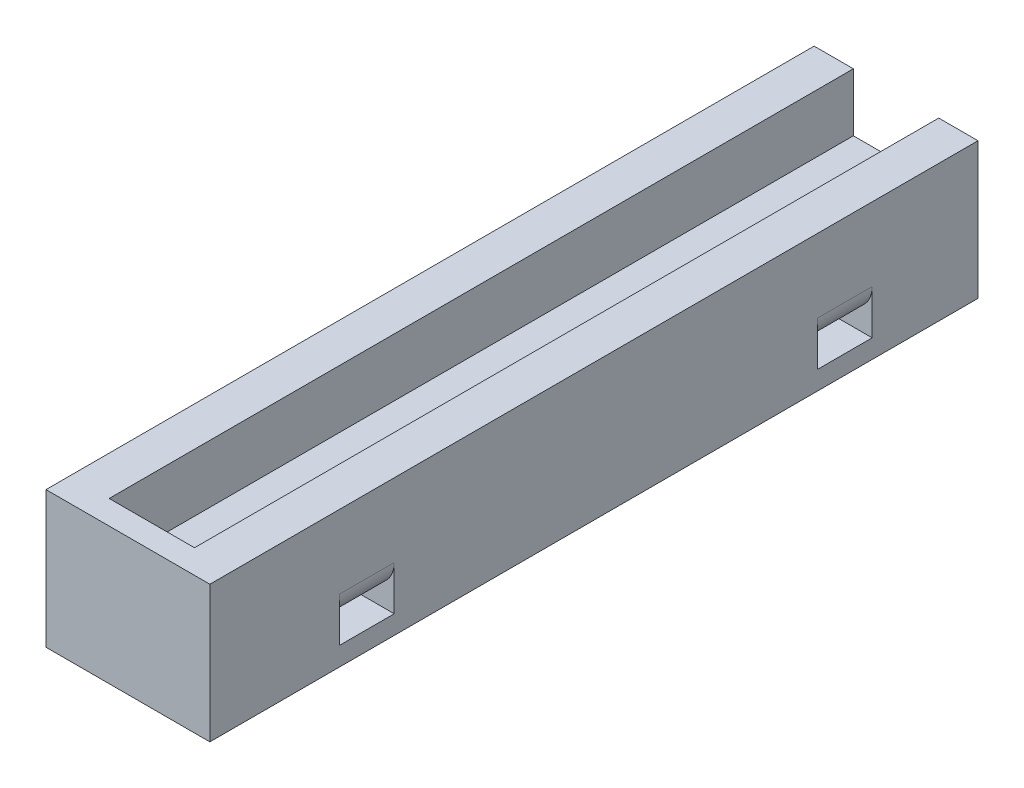
from build123d import *

# Parameters (mm, degrees)
SKETCH1_W                 = 12.5
SKETCH1_H                 = 11.5
BOSS_EXTRUDE1_DEPTH       = 109
SKETCH2_W                 = 24
SKETCH2_H                 = 20
BOSS_EXTRUDE2_DEPTH       = 3.5
F_2_5MM_DOWEL_HOLE1_D     = 3.2
F_2_5MM_DOWEL_HOLE1_DEPTH = 6.5
F_2_5MM_DOWEL_HOLE1_TIP   = 0.96137699
SKETCH5_W                 = 8
SKETCH5_H                 = 2.5
CUT_EXTRUDE1_DEPTH        = 117.757226757
FILLET1_R                 = 4


with BuildPart() as part:
    # Sketch1 → Boss-Extrude1 (new body)
    with BuildSketch(Plane.XY):
        Polygon((-37.25, 0), (-37.25, 11.5), (-37.25, 20), (-43, 20), (-43, 0), align=None)
        with Locations((-31, 5.75)):
            Rectangle(SKETCH1_W, SKETCH1_H)
        Polygon((-24.75, 20), (-24.75, 11.5), (-24.75, 0), (-19, 0), (-19, 20), align=None)
    extrude(amount=BOSS_EXTRUDE1_DEPTH)

    # Sketch2 → Boss-Extrude2 (add)
    with BuildSketch(Plane.XY.offset(109)):
        with Locations((-31, 10)):
            Rectangle(SKETCH2_W, SKETCH2_H)
    extrude(amount=BOSS_EXTRUDE2_DEPTH)

    # Ø2.5mm Dowel Hole1
    with Locations(Plane(origin=(0, 0, 0), x_dir=(-1, 0, 0), z_dir=(0, 0, -1))):
        with Locations((36, 5.6), (26, 5.6)):
            Hole(F_2_5MM_DOWEL_HOLE1_D / 2, depth=F_2_5MM_DOWEL_HOLE1_DEPTH)
            with Locations((0, 0, -(F_2_5MM_DOWEL_HOLE1_DEPTH + F_2_5MM_DOWEL_HOLE1_TIP / 2))):  # 118° drill point
                Cone(0, F_2_5MM_DOWEL_HOLE1_D / 2, F_2_5MM_DOWEL_HOLE1_TIP, mode=Mode.SUBTRACT)

    # Sketch5 → Cut-Extrude1 (cut, through all)
    with BuildSketch(Plane(origin=(-19, 0, 0), x_dir=(0, 0, -1), z_dir=(1, 0, 0))):
        with Locations((-89.5, 4)):
            Rectangle(SKETCH5_W, SKETCH5_H)
        with Locations((-19.5, 4)):
            Rectangle(SKETCH5_W, SKETCH5_H)
    extrude(amount=-CUT_EXTRUDE1_DEPTH, mode=Mode.SUBTRACT)

    # Fillet1
    fillet1_edges = [part.edges().sort_by_distance(p)[0] for p in [
        (-43, 5.25, 89.5),
        (-19, 5.25, 89.5),
        (-43, 5.25, 19.5),
        (-19, 5.25, 19.5),
    ]]
    fillet(fillet1_edges, radius=FILLET1_R)


solid = part.part
